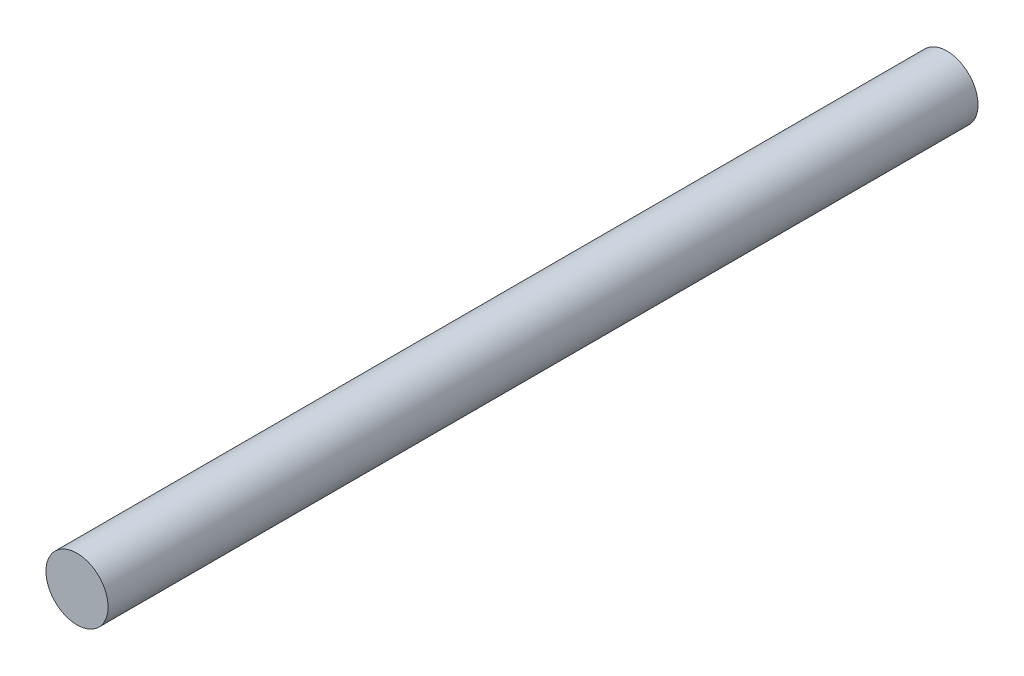
from build123d import *

# Parameters (mm, degrees)
SKETCH1_W = 1.5
SKETCH1_H = 42


with BuildPart() as part:
    # Sketch1 → Revolve1 (revolve)
    with BuildSketch(Plane(origin=(0, 0, 0), x_dir=(-1, 0, 0), z_dir=(0, 1, 0))):
        with Locations((-30.75, 0)):
            Rectangle(SKETCH1_W, SKETCH1_H)
    revolve(axis=Axis((30, 0, -21), (0, 0, 1)))


solid = part.part
